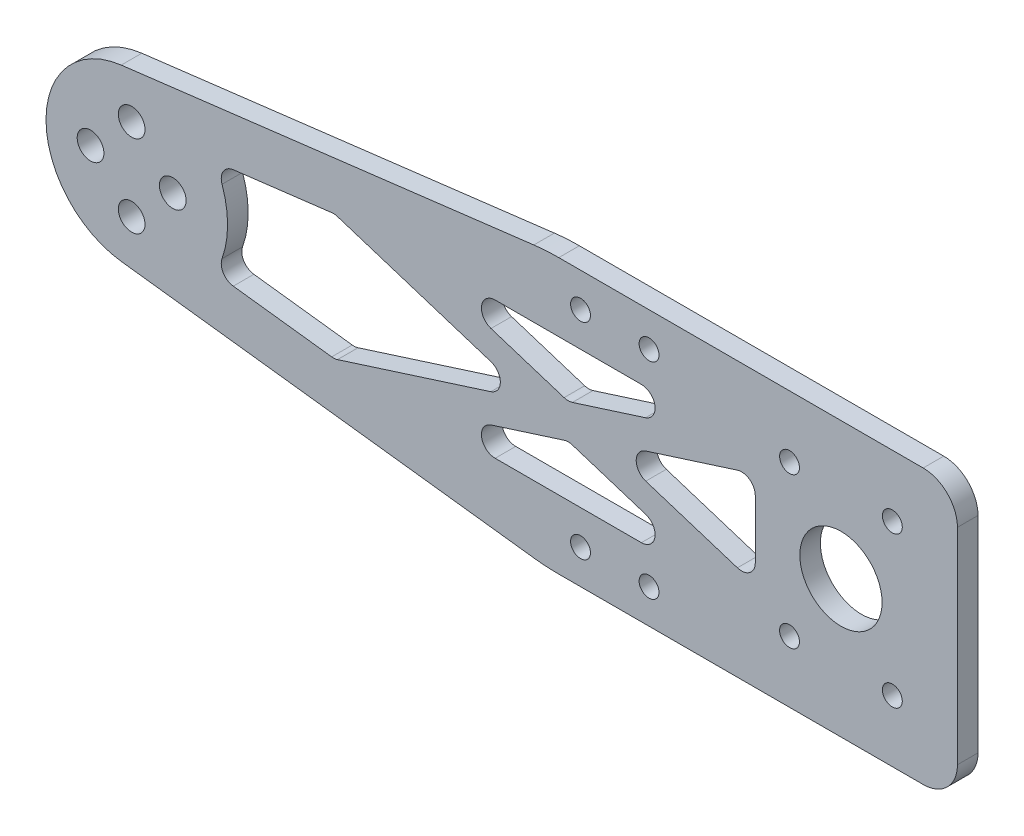
from build123d import *

# Parameters (mm, degrees)
EXTRUDE_1_DEPTH          = 3
CUT_EXTRUDE_1_DEPTH      = 123.185310083
CUT_EXTRUDE_1_DEPTH_BACK = 123.185310083
SKETCH_2_R               = 1.95
FILLET_1_R               = 5
SKETCH_3_R               = 1.45
CUT_EXTRUDE_2_DEPTH      = 123.185310083
SKETCH_4_R               = 1.45
CUT_EXTRUDE_3_DEPTH      = 123.185310083
FILLET_2_R               = 30
SKETCH_6_R               = 6
CUT_EXTRUDE_4_DEPTH      = 123.185310083
FILLET_3_R               = 2


with BuildPart() as part:
    # 草图1 → 凸台-拉伸1 (new body)
    with BuildSketch(Plane.XY):
        with BuildLine():
            Line((60.5, 20), (120.5, 20))
            Line((120.5, 20), (120.5, -20))
            Line((120.5, -20), (60.5, -20))
            Line((60.5, -20), (-1.51896419, -12.407366674))
            ThreePointArc((-1.51896419, -12.407366674), (-12.5, 0), (-1.51896419, 12.407366674))
            Line((-1.51896419, 12.407366674), (60.5, 20))
        make_face()
    extrude(amount=EXTRUDE_1_DEPTH)

    # 草图2 → 切除-拉伸1 (cut, two sides: drawn at the far end of the back side and taken through both)
    with BuildSketch(Plane.XY.offset(3).offset(-CUT_EXTRUDE_1_DEPTH_BACK)):
        with Locations((0, 6)):
            Circle(SKETCH_2_R)
        with Locations((6, 0)):
            Circle(SKETCH_2_R)
        with Locations((0, -6)):
            Circle(SKETCH_2_R)
        with Locations((-6, 0)):
            Circle(SKETCH_2_R)
    extrude(amount=CUT_EXTRUDE_1_DEPTH + CUT_EXTRUDE_1_DEPTH_BACK, mode=Mode.SUBTRACT)

    # 圆角1
    fillet_1_edges = [part.edges().sort_by_distance(p)[0] for p in [
        (120.5, 20, 1.5),
        (120.5, -20, 1.5),
    ]]
    fillet(fillet_1_edges, radius=FILLET_1_R)

    # 草图3 → 切除-拉伸2 (cut, through all)
    with BuildSketch(Plane(origin=(0, 0, 0), x_dir=(-1, 0, 0), z_dir=(0, 0, -1))):
        with Locations((-111, -11)):
            Circle(SKETCH_3_R)
        with Locations((-111, 11)):
            Circle(SKETCH_3_R)
        with Locations((-96, 11)):
            Circle(SKETCH_3_R)
        with Locations((-96, -11)):
            Circle(SKETCH_3_R)
    extrude(amount=-CUT_EXTRUDE_2_DEPTH, mode=Mode.SUBTRACT)

    # 草图4 → 切除-拉伸3 (cut, through all)
    with BuildSketch(Plane.XY.offset(3)):
        with Locations((75.5, 15)):
            Circle(SKETCH_4_R)
        with Locations((65.5, 15)):
            Circle(SKETCH_4_R)
        with Locations(Location((65.5, -15, 0), (0, 0, 180))):
            Circle(SKETCH_4_R)
        with Locations(Location((75.5, -15, 0), (0, 0, 180))):
            Circle(SKETCH_4_R)
    extrude(amount=-CUT_EXTRUDE_3_DEPTH, mode=Mode.SUBTRACT)

    # 圆角2
    fillet_2_edges = [part.edges().sort_by_distance(p)[0] for p in [
        (60.5, 20, 1.5),
        (60.5, -20, 1.5),
    ]]
    fillet(fillet_2_edges, radius=FILLET_2_R)

    # 草图6 → 切除-拉伸4 (cut, through all)
    with BuildSketch(Plane.XY.offset(3)):
        with Locations((103.5, 0)):
            Circle(SKETCH_6_R)
        with BuildLine():
            Line((12.110641117, 7.023700714), (29.621886423, 9.167504088))
            Line((29.621886423, 9.167504088), (58.382978877, 0))
            Line((58.382978877, 0), (29.621886423, -9.167504088))
            Line((29.621886423, -9.167504088), (12.110641117, -7.023700714))
            ThreePointArc((12.110641117, -7.023700714), (14, 0), (12.110641117, 7.023700714))
        make_face()
        Polygon((40.181331173, -10), (63.710984536, -2.5), (87.240637899, -10), align=None)
        Polygon((40.181331173, 10), (63.710984536, 2.5), (87.240637899, 10), align=None)
        Polygon((91, 7), (69.038990194, 0), (91, -7), align=None)
    extrude(amount=-CUT_EXTRUDE_4_DEPTH, mode=Mode.SUBTRACT)

    # 圆角3
    fillet_3_edges = [part.edges().sort_by_distance(p)[0] for p in [
        (40.181331173, 10, 1.5),
        (87.240637899, 10, 1.5),
        (63.710984536, 2.5, 1.5),
        (91, 7, 1.5),
        (91, -7, 1.5),
        (69.038990194, 0, 1.5),
        (87.240637899, -10, 1.5),
        (40.181331173, -10, 1.5),
        (63.710984536, -2.5, 1.5),
        (12.110641117, -7.023700714, 1.5),
        (12.110641117, 7.023700714, 1.5),
        (29.621886423, 9.167504088, 1.5),
        (58.382978877, 0, 1.5),
        (29.621886423, -9.167504088, 1.5),
    ]]
    fillet(fillet_3_edges, radius=FILLET_3_R)


solid = part.part
